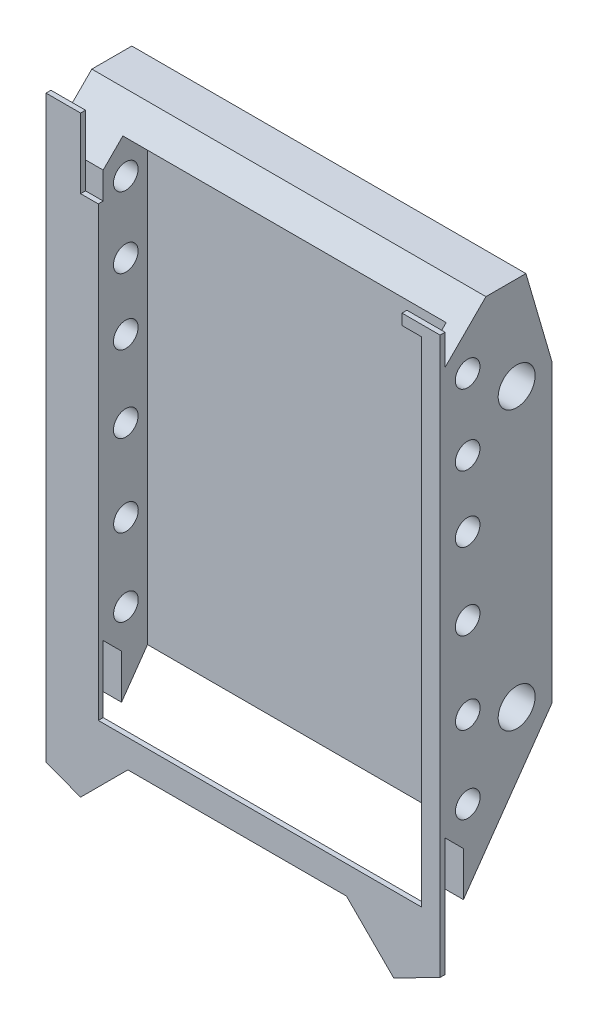
from build123d import *

# Parameters (mm, degrees)
BOSS_EXTRUDE1_DEPTH = 2.54
BOSS_EXTRUDE2_REACH = 281.854
SKETCH3_R           = 9.525
CUT_EXTRUDE1_DEPTH  = 286.222196584
SKETCH4_R           = 6.35
CUT_EXTRUDE2_DEPTH  = 286.222196584
SKETCH5_W           = 166.701294092
SKETCH5_H           = 254.634379314
CUT_EXTRUDE3_DEPTH  = 25.4


with BuildPart() as part:
    # Sketch1 → Boss-Extrude1 (new body)
    with BuildSketch(Plane.XY):
        Polygon((-154.89754402, 192.409602109), (-154.89754402, -106.378927356), (-137.076300146, -113.087952221), (-112.691620976, -88.703273051), (0, -88.703273051), (24.38467917, -113.087952221), (48.30245598, -100.895612636), (48.30245598, -46.801532207), (48.30245598, 185.942762537), (28.636463872, 185.942762537), (28.636463872, 156.398467793), (-137.076300146, 156.398467793), (-137.076300146, 192.409602109), align=None)
    extrude(amount=BOSS_EXTRUDE1_DEPTH)

    # Boss-Extrude2: up to this face of the body (flat: up to its plane)
    boss_extrude2_end = Plane(part.part.faces().sort_by_distance((-154.89754402, 43.015337376, 1.27))[0])
    # Sketch2 → Boss-Extrude2 (add, up to the picked face)
    with BuildSketch(Plane(origin=(48.30245598, 0, 0), x_dir=(0, 0, -1), z_dir=(1, 0, 0)), mode=Mode.PRIVATE) as boss_extrude2_sk1:
        Polygon((0, 170.234631614), (21.075391445, 191.310023059), (41.695088388, 191.310023059), (55.136253414, 145.191484573), (55.136253414, -7.208515427), (9.464727664, -72.14198279), (9.464727664, -49.306219915), (0, -39.841492251), align=None)
    boss_extrude2_tool1 = split(extrude(boss_extrude2_sk1.sketch, amount=-BOSS_EXTRUDE2_REACH, mode=Mode.PRIVATE), bisect_by=boss_extrude2_end, keep=Keep.BOTH, mode=Mode.PRIVATE)
    add(boss_extrude2_tool1.solids().sort_by(Axis((48.302456, 70.213482, -26.354357), (-1, 0, 0)))[0])

    # Sketch3 → Cut-Extrude1 (cut, through all)
    with BuildSketch(Plane(origin=(48.30245598, 0, 0), x_dir=(0, 0, -1), z_dir=(1, 0, 0))):
        with Locations((36.933690773, 143.349042369)):
            Circle(SKETCH3_R)
        with Locations((36.933690773, 0)):
            Circle(SKETCH3_R)
    extrude(amount=-CUT_EXTRUDE1_DEPTH, mode=Mode.SUBTRACT)

    # Sketch4 → Cut-Extrude2 (cut, through all)
    with BuildSketch(Plane(origin=(48.30245598, 0, 0), x_dir=(0, 0, -1), z_dir=(1, 0, 0))):
        with Locations((11.650142798, 161.721177387)):
            Circle(SKETCH4_R)
        with Locations((11.736614281, 9.321201919)):
            Circle(SKETCH4_R)
        with Locations((11.650142798, 125.160679587)):
            Circle(SKETCH4_R)
        with Locations((11.650142798, 91.064352978)):
            Circle(SKETCH4_R)
        with Locations((11.650142798, 51.543610773)):
            Circle(SKETCH4_R)
        with Locations((11.736614281, -30.597539694)):
            Circle(SKETCH4_R)
    extrude(amount=-CUT_EXTRUDE2_DEPTH, mode=Mode.SUBTRACT)

    # Sketch5 → Cut-Extrude3 (cut)
    with BuildSketch(Plane.XY.offset(2.54)):
        with Locations((-44.614217323, 53.073750236)):
            Rectangle(SKETCH5_W, SKETCH5_H)
    extrude(amount=-CUT_EXTRUDE3_DEPTH, mode=Mode.SUBTRACT)


solid = part.part
